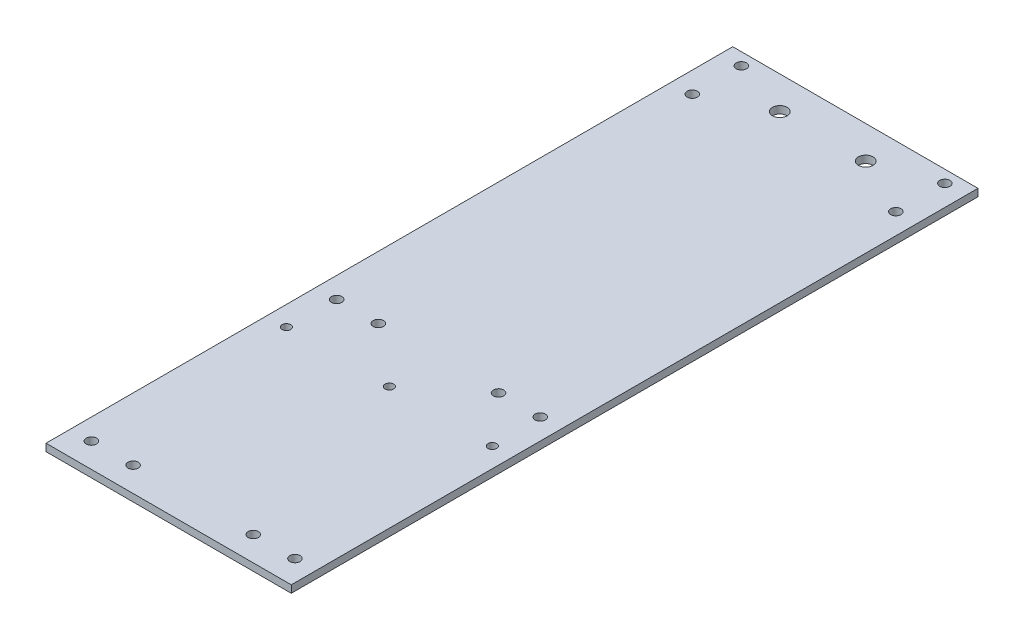
from build123d import *

# Parameters (mm, degrees)
SKETCH1_W           = 100
SKETCH1_H           = 120
SKETCH1_R           = 2.1
SKETCH1_R_2         = 1.75
BOSS_EXTRUDE1_DEPTH = 3
SKETCH2_R           = 2.1
CUT_EXTRUDE1_DEPTH  = 10
SKETCH3_W           = 100
SKETCH3_H           = 3
BOSS_EXTRUDE2_DEPTH = 160
SKETCH4_R           = 3
SKETCH4_R_2         = 2.1
CUT_EXTRUDE2_DEPTH  = 160


with BuildPart() as part:
    # Sketch1 → Boss-Extrude1 (new body)
    with BuildSketch(Plane(origin=(0, 0, 0), x_dir=(1, 0, 0), z_dir=(0, 1, 0))):
        Rectangle(SKETCH1_W, SKETCH1_H)
        with Locations(Location((41.5, 50, 0), (0, 0, 270))):
            Circle(SKETCH1_R, mode=Mode.SUBTRACT)
        with Locations(Location((41.5, -50, 0), (0, 0, 90))):
            Circle(SKETCH1_R, mode=Mode.SUBTRACT)
        with Locations(Location((-41.5, -50, 0), (0, 0, 270))):
            Circle(SKETCH1_R, mode=Mode.SUBTRACT)
        with Locations(Location((-41.5, 50, 0), (0, 0, 90))):
            Circle(SKETCH1_R, mode=Mode.SUBTRACT)
        with Locations(Location((-42, 30, 0), (0, 0, 270))):
            Circle(SKETCH1_R_2, mode=Mode.SUBTRACT)
        with Locations(Location((0, 30, 0), (0, 0, 270))):
            Circle(SKETCH1_R_2, mode=Mode.SUBTRACT)
        with Locations(Location((42, 30, 0), (0, 0, 270))):
            Circle(SKETCH1_R_2, mode=Mode.SUBTRACT)
    extrude(amount=BOSS_EXTRUDE1_DEPTH)

    # Sketch2 → Cut-Extrude1 (cut)
    with BuildSketch(Plane.XZ):
        with Locations(Location((-24.5, -50, 0), (0, 0, 270))):
            Circle(SKETCH2_R)
        with Locations(Location((24.5, -50, 0), (0, 0, 270))):
            Circle(SKETCH2_R)
        with Locations(Location((24.5, 50, 0), (0, 0, 270))):
            Circle(SKETCH2_R)
        with Locations(Location((-24.5, 50, 0), (0, 0, 270))):
            Circle(SKETCH2_R)
    extrude(amount=-CUT_EXTRUDE1_DEPTH, mode=Mode.SUBTRACT)

    # Sketch3 → Boss-Extrude2 (add)
    with BuildSketch(Plane(origin=(0, 0, -60), x_dir=(-1, 0, 0), z_dir=(0, 0, -1))):
        with Locations((0, 1.5)):
            Rectangle(SKETCH3_W, SKETCH3_H)
    extrude(amount=BOSS_EXTRUDE2_DEPTH)

    # Sketch4 → Cut-Extrude2 (cut)
    with BuildSketch(Plane.XZ):
        with Locations(Location((17.5, -206.7, 0), (0, 0, 270))):
            Circle(SKETCH4_R)
        with Locations(Location((-17.5, -206.7, 0), (0, 0, 270))):
            Circle(SKETCH4_R)
        with Locations(Location((-41.5, -215, 0), (0, 0, 270))):
            Circle(SKETCH4_R_2)
        with Locations(Location((-41.5, -195, 0), (0, 0, 270))):
            Circle(SKETCH4_R_2)
        with Locations(Location((41.5, -195, 0), (0, 0, 270))):
            Circle(SKETCH4_R_2)
        with Locations(Location((41.5, -215, 0), (0, 0, 270))):
            Circle(SKETCH4_R_2)
    extrude(amount=-CUT_EXTRUDE2_DEPTH, mode=Mode.SUBTRACT)


solid = part.part
